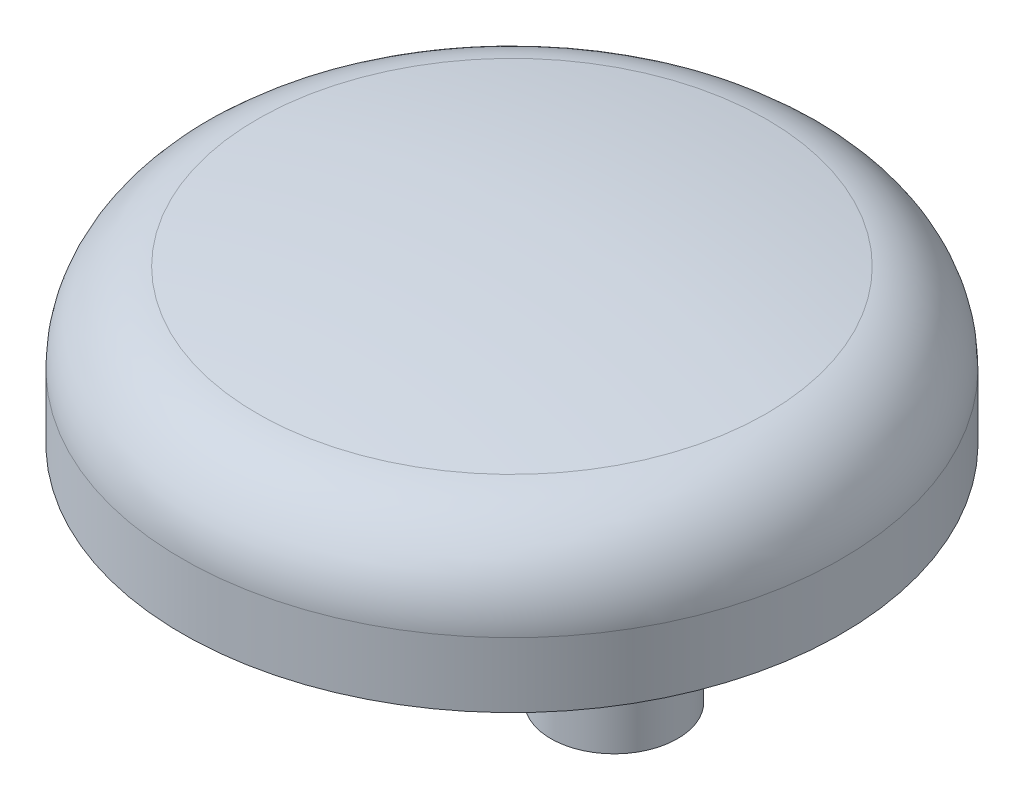
from build123d import *

# Parameters (mm, degrees)
SKETCH4_R           = 6.35
BOSS_EXTRUDE2_DEPTH = 21.082


with BuildPart() as part:
    # Sketch3 → Revolve1 (revolve)
    with BuildSketch(Plane.XY, mode=Mode.PRIVATE) as revolve1_sk:
        with BuildLine():
            Line((0, 0), (33.02, 0))
            Line((33.02, 0), (33.02, 6.49997073))
            ThreePointArc((33.02, 6.49997073), (30.896328324, 12.306528126), (25.527531381, 15.372814081))
            ThreePointArc((25.527531381, 15.372814081), (12.809089234, 16.986749481), (0, 17.526))
            Line((0, 17.526), (0, 0))
        make_face()
    revolve(revolve1_sk.sketch.rotate(Axis((0, -21.575765897, 0), (0, 1, 0)), 90), axis=Axis((0, -21.575765897, 0), (0, 1, 0)))

    # Sketch4 → Boss-Extrude2 (add)
    with BuildSketch(Plane.XZ):
        with Locations(Location((6.477, -3.77, 0), (0, 0, 270))):
            Circle(SKETCH4_R)
    extrude(amount=BOSS_EXTRUDE2_DEPTH)


solid = part.part
